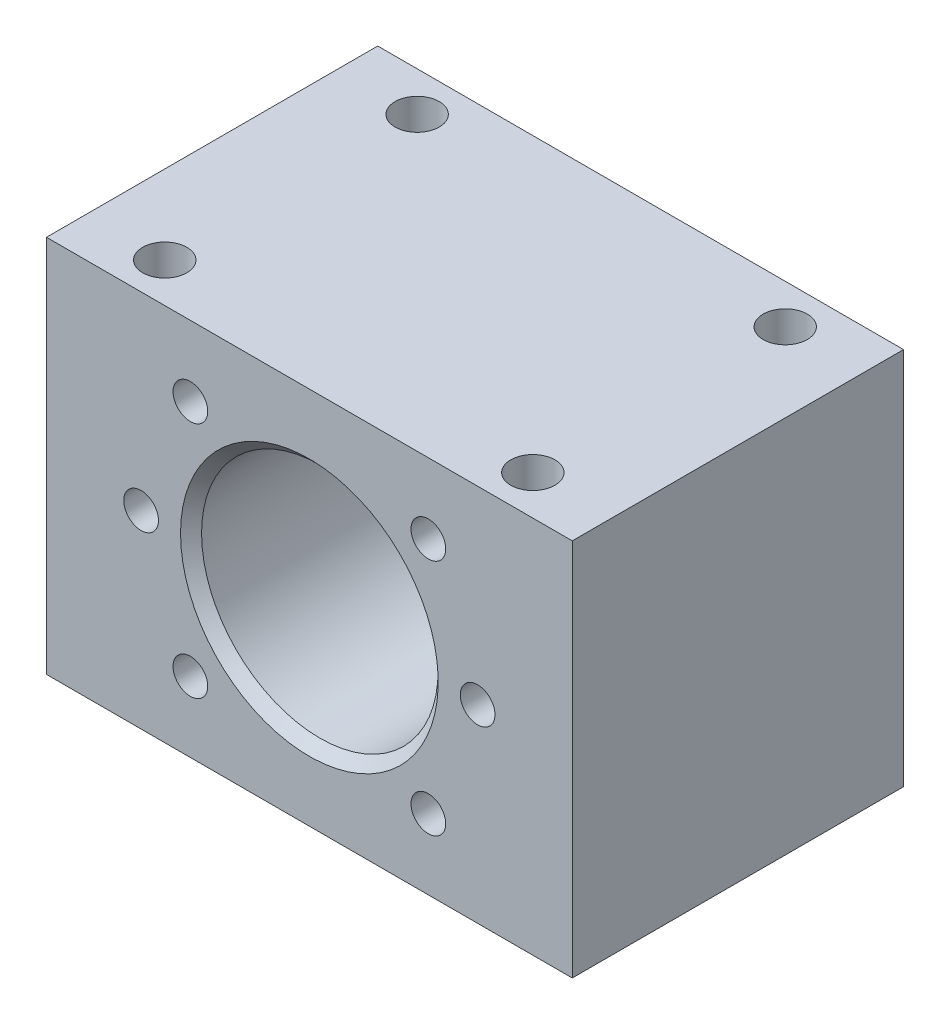
from build123d import *

# Parameters (mm, degrees)
ESQUISSE1_W               = 50
ESQUISSE1_H               = 36
BOSS_EXTRU_1_DEPTH        = 31.5
ESQUISSE2_R               = 11.25
ENL_V_MAT_EXTRU_1_DEPTH   = 31.5
TROU_TARAUD_M4X0_71_D     = 3.3
TROU_TARAUD_M4X0_71_DEPTH = 12
TROU_TARAUD_M4X0_71_TIP   = 0.991420021
TROU_TARAUD_M5X0_81_D     = 4.2
TROU_TARAUD_M5X0_81_DEPTH = 14
TROU_TARAUD_M5X0_81_TIP   = 1.2618073
CHANFREIN1_SIZE           = 1


with BuildPart() as part:
    # Esquisse1 → Boss.-Extru.1 (new body)
    with BuildSketch(Plane.XY):
        Rectangle(ESQUISSE1_W, ESQUISSE1_H)
    extrude(amount=BOSS_EXTRU_1_DEPTH)

    # Esquisse2 → Enlèv. mat.-Extru.1 (cut)
    with BuildSketch(Plane.XY.offset(31.5)):
        Circle(ESQUISSE2_R)
    extrude(amount=-ENL_V_MAT_EXTRU_1_DEPTH, mode=Mode.SUBTRACT)

    # Trou taraudé M4x0.71
    with Locations(Plane.XY.offset(31.5)):
        with Locations((-11.313708499, 11.313708499), (-16, 0), (-11.313708499, -11.313708499), (11.313708499, -11.313708499), (16, 0), (11.313708499, 11.313708499)):
            Hole(TROU_TARAUD_M4X0_71_D / 2, depth=TROU_TARAUD_M4X0_71_DEPTH)
            with Locations((0, 0, -(TROU_TARAUD_M4X0_71_DEPTH + TROU_TARAUD_M4X0_71_TIP / 2))):  # 118° drill point
                Cone(0, TROU_TARAUD_M4X0_71_D / 2, TROU_TARAUD_M4X0_71_TIP, mode=Mode.SUBTRACT)

    # Trou taraudé M5x0.81
    with Locations(Plane(origin=(0, 18, 0), x_dir=(1, 0, 0), z_dir=(0, 1, 0))):
        with Locations((-17.5, -27.75), (-17.5, -3.75), (17.5, -3.75), (17.5, -27.75)):
            Hole(TROU_TARAUD_M5X0_81_D / 2, depth=TROU_TARAUD_M5X0_81_DEPTH)
            with Locations((0, 0, -(TROU_TARAUD_M5X0_81_DEPTH + TROU_TARAUD_M5X0_81_TIP / 2))):  # 118° drill point
                Cone(0, TROU_TARAUD_M5X0_81_D / 2, TROU_TARAUD_M5X0_81_TIP, mode=Mode.SUBTRACT)

    # Chanfrein1
    chanfrein1_edges = [part.edges().sort_by_distance(p)[0] for p in [
        (-11.25, 0, 0),
        (-11.25, 0, 31.5),
    ]]
    chamfer(chanfrein1_edges, length=CHANFREIN1_SIZE)


solid = part.part
